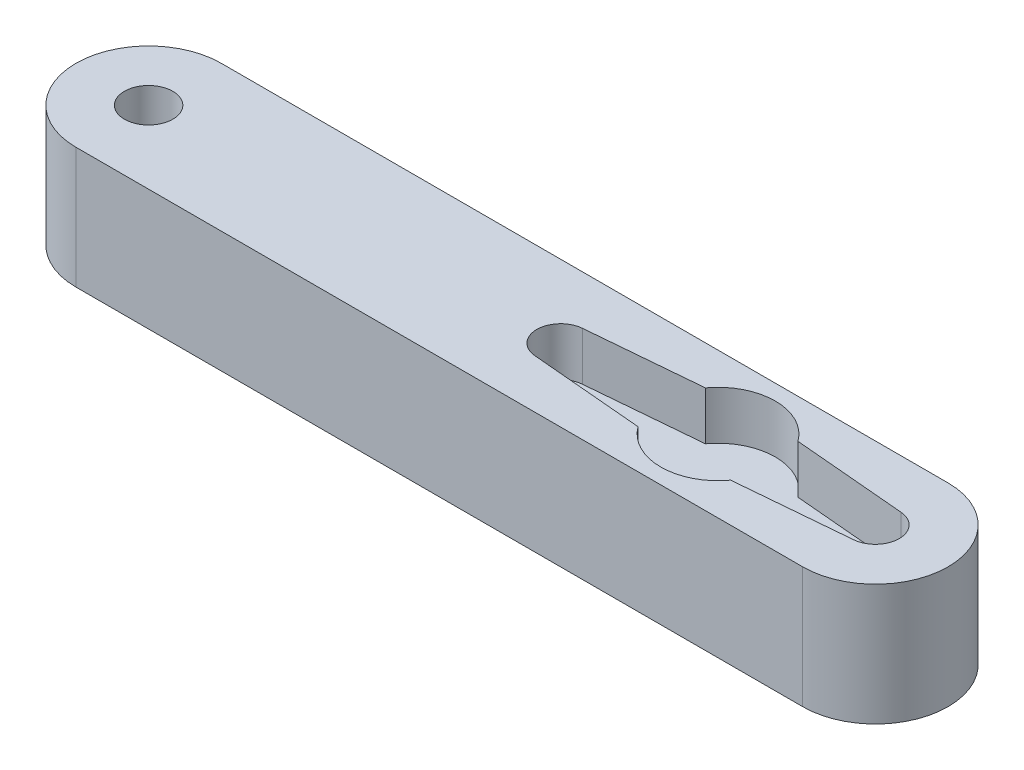
from build123d import *

# Parameters (mm, degrees)
BOSS_EXTRUDE1_DEPTH = 12.7
SKETCH4_R           = 2.54
CUT_EXTRUDE3_DEPTH  = 55.135379374
CUT_EXTRUDE6_DEPTH  = 5.08


with BuildPart() as part:
    # Sketch3 → Boss-Extrude1 (new body)
    with BuildSketch(Plane(origin=(0, 0, 0), x_dir=(1, 0, 0), z_dir=(0, 1, 0))):
        with BuildLine():
            Line((-31.75, 7.62), (44.45, 7.62))
            ThreePointArc((44.45, 7.62), (52.07, 0), (44.45, -7.62))
            Line((44.45, -7.62), (-31.75, -7.62))
            ThreePointArc((-31.75, -7.62), (-39.37, 0), (-31.75, 7.62))
        make_face()
    extrude(amount=BOSS_EXTRUDE1_DEPTH)

    # Sketch4 → Cut-Extrude3 (cut, through all)
    with BuildSketch(Plane(origin=(0, 12.7, 0), x_dir=(1, 0, 0), z_dir=(0, 1, 0))):
        with Locations(Location((-31.75, 0, 0), (0, 0, 270))):
            Circle(SKETCH4_R)
    extrude(amount=-CUT_EXTRUDE3_DEPTH, mode=Mode.SUBTRACT)

    # Sketch9 → Cut-Extrude6 (cut)
    with BuildSketch(Plane(origin=(0, 12.7, 0), x_dir=(-1, 0, 0), z_dir=(0, 1, 0))):
        with BuildLine():
            Line((-11.232110643, -2.490486745), (-23.097234737, -3.528550595))
            ThreePointArc((-23.097234737, -3.528550595), (-27.95, -6), (-32.802765263, -3.528550595))
            Line((-32.802765263, -3.528550595), (-44.667889357, -2.490486745))
            ThreePointArc((-44.667889357, -2.490486745), (-46.95, 0), (-44.667889357, 2.490486745))
            Line((-44.667889357, 2.490486745), (-32.802765263, 3.528550595))
            ThreePointArc((-32.802765263, 3.528550595), (-27.95, 6), (-23.097234737, 3.528550595))
            Line((-23.097234737, 3.528550595), (-11.232110643, 2.490486745))
            ThreePointArc((-11.232110643, 2.490486745), (-8.95, 0), (-11.232110643, -2.490486745))
        make_face()
    extrude(amount=-CUT_EXTRUDE6_DEPTH, mode=Mode.SUBTRACT)


solid = part.part
